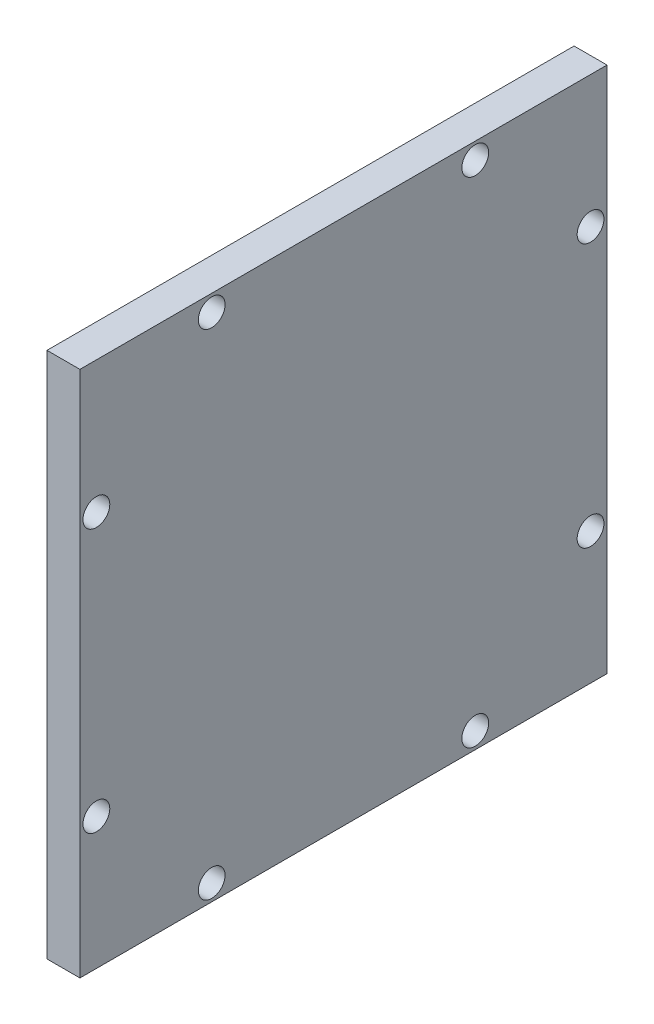
from build123d import *

# Parameters (mm, degrees)
SKETCH1_W           = 48
SKETCH1_H           = 48
BOSS_EXTRUDE1_DEPTH = 3
SKETCH11_R          = 1.22
CUT_EXTRUDE1_DEPTH  = 3


with BuildPart() as part:
    # Sketch1 → Boss-Extrude1 (new body)
    with BuildSketch(Plane(origin=(0, 0, 0), x_dir=(0, 0, -1), z_dir=(1, 0, 0))):
        with Locations((24, 24)):
            Rectangle(SKETCH1_W, SKETCH1_H)
    extrude(amount=BOSS_EXTRUDE1_DEPTH)

    # Sketch11 → Cut-Extrude1 (cut)
    with BuildSketch(Plane(origin=(3, 0, 0), x_dir=(0, 0, -1), z_dir=(1, 0, 0))):
        with Locations((12, 46.5)):
            Circle(SKETCH11_R)
        with Locations((36, 46.5)):
            Circle(SKETCH11_R)
        with Locations((12, 1.5)):
            Circle(SKETCH11_R)
        with Locations((36, 1.5)):
            Circle(SKETCH11_R)
        with Locations((1.5, 36)):
            Circle(SKETCH11_R)
        with Locations((1.5, 12)):
            Circle(SKETCH11_R)
        with Locations((46.5, 36)):
            Circle(SKETCH11_R)
        with Locations((46.5, 12)):
            Circle(SKETCH11_R)
    extrude(amount=-CUT_EXTRUDE1_DEPTH, mode=Mode.SUBTRACT)


solid = part.part
